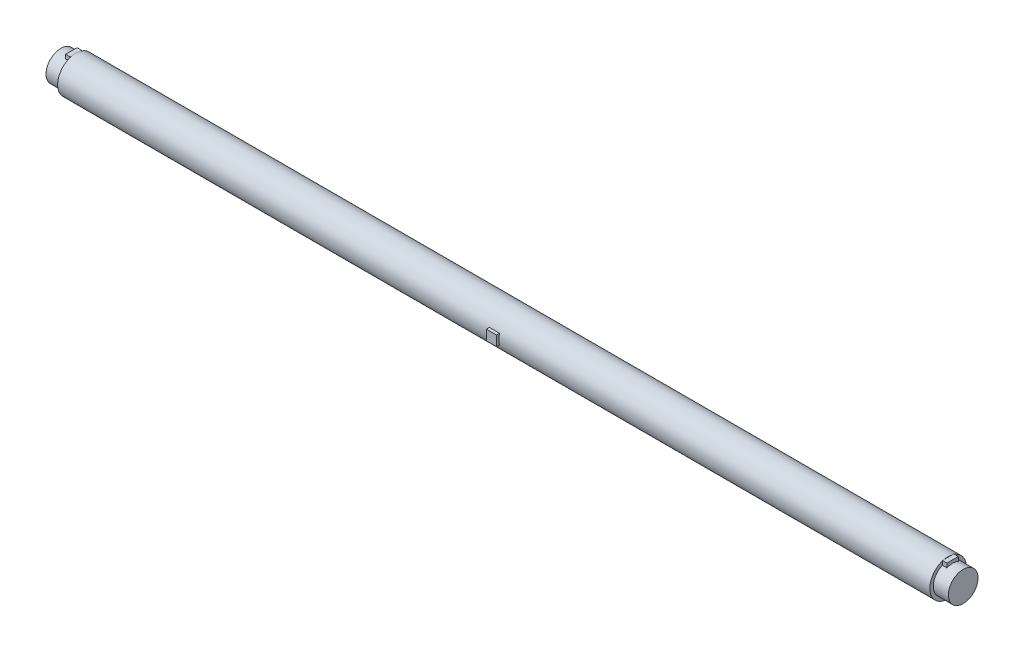
from build123d import *

# Parameters (mm, degrees)
BOSS_EXTRUDE1_REACH      = 994.465
BOSS_EXTRUDE1_END_RADIUS = 40
SKETCH4_W                = 22.36
SKETCH4_H                = 22
BOSS_EXTRUDE2_DEPTH      = 10


with BuildPart() as part:
    # Sketch1 → Revolve1 (revolve)
    with BuildSketch(Plane.XY):
        Polygon((-988, 0), (-988, 32.5), (-955, 32.5), (-955, 40), (955, 40), (955, 32.5), (988, 32.5), (988, 0), align=None)
    revolve(axis=Axis((988, 0, 0), (-1, 0, 0)))

    # Boss-Extrude1: up to this cylinder (the profile starts outside it)
    boss_extrude1_end = Plane(origin=(0, 0, 0), z_dir=(1, 0, 0)) * Cylinder(BOSS_EXTRUDE1_END_RADIUS, 2069.93, mode=Mode.PRIVATE)
    # Sketch4 → Boss-Extrude1 (add, up to the surface)
    with BuildSketch(Plane.XY.offset(45.1), mode=Mode.PRIVATE) as boss_extrude1_sk1:
        Rectangle(SKETCH4_W, SKETCH4_H)
    boss_extrude1_tool1 = extrude(boss_extrude1_sk1.sketch, amount=-BOSS_EXTRUDE1_REACH, mode=Mode.PRIVATE) - boss_extrude1_end
    add(boss_extrude1_tool1.solids().sort_by_distance((0, 0, 45.1))[0])

    # Sketch5 → Boss-Extrude2 (add)
    with BuildSketch(Plane.ZY.offset(955)):
        with BuildLine():
            Line((-12.5, 30), (-12.5, 39.13))
            Line((-12.5, 39.13), (12.5, 39.13))
            Line((12.5, 39.13), (12.5, 30))
            ThreePointArc((12.5, 30), (0, 32.5), (-12.5, 30))
        make_face()
    boss_extrude2 = extrude(amount=BOSS_EXTRUDE2_DEPTH)

    # Mirror1: Boss-Extrude2 across plane
    add(boss_extrude2.mirror(Plane.ZY))


solid = part.part
